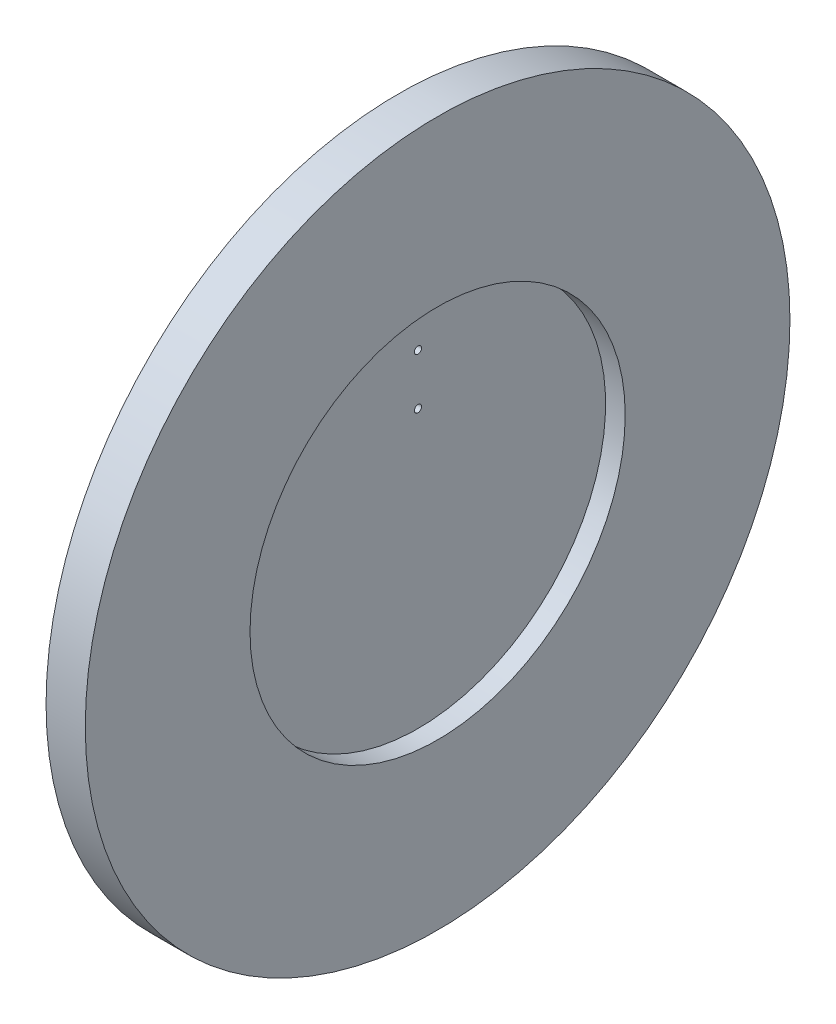
from build123d import *

# Parameters (mm, degrees)
SKETCH1_R                   = 89.825
SKETCH1_R_2                 = 47.825
BOSS_EXTRUDE1_DEPTH         = 10
SKETCH3_R                   = 47.825
TBH_IDK_DEPTH               = 5
EXTRUSION_START             = 5
SKETCH4_R                   = 47.825
EXTRUSION_TO_FUEL_MAN_DEPTH = 5
OX_DOWNCOMER_REACH          = 129.914
OX_PROFILE_R                = 0.914623685


with BuildPart() as part:
    # Sketch1 → Boss-Extrude1 (new body)
    with BuildSketch(Plane(origin=(0, 0, 0), x_dir=(0, 0, -1), z_dir=(1, 0, 0))):
        Circle(SKETCH1_R)
        Circle(SKETCH1_R_2, mode=Mode.SUBTRACT)
    extrude(amount=BOSS_EXTRUDE1_DEPTH)

    # Sketch3 → tbh idk (add)
    with BuildSketch(Plane.ZY):
        Circle(SKETCH3_R)
    extrude(amount=-TBH_IDK_DEPTH)

    # Sketch4 → Extrusion to Fuel Man (add)
    with BuildSketch(Plane.ZY.offset(EXTRUSION_START)):
        Circle(SKETCH4_R)
    extrude(amount=-EXTRUSION_TO_FUEL_MAN_DEPTH)

    # Ox Profile → Ox Downcomer (cut, up to next)
    with BuildSketch(Plane.ZY.offset(5), mode=Mode.PRIVATE) as ox_downcomer_sk1:
        with Locations((0, 22.818498385)):
            Circle(OX_PROFILE_R)
    ox_downcomer_tool1 = extrude(ox_downcomer_sk1.sketch, amount=-OX_DOWNCOMER_REACH, mode=Mode.PRIVATE) & part.part
    # Ox Profile → Ox Downcomer (cut, up to next)
    with BuildSketch(Plane.ZY.offset(5), mode=Mode.PRIVATE) as ox_downcomer_sk2:
        with Locations((0, 35.746701615)):
            Circle(OX_PROFILE_R)
    ox_downcomer_tool2 = extrude(ox_downcomer_sk2.sketch, amount=-OX_DOWNCOMER_REACH, mode=Mode.PRIVATE) & part.part
    add(ox_downcomer_tool1.solids().sort_by_distance((-5, 22.818498, 0))[0], mode=Mode.SUBTRACT)
    add(ox_downcomer_tool2.solids().sort_by_distance((-5, 35.746702, 0))[0], mode=Mode.SUBTRACT)


solid = part.part
